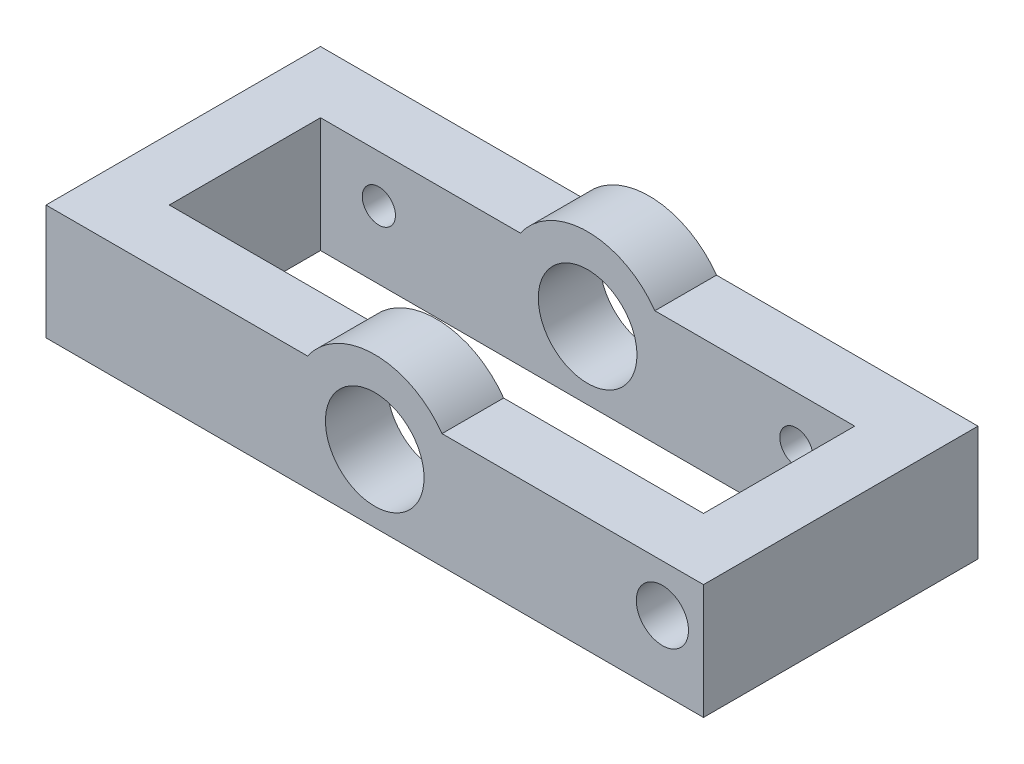
from build123d import *
from build123d.topology import SkipClean

# Parameters (mm, degrees)
SKETCH1_W           = 65
SKETCH1_H           = 18.4
BOSS_EXTRUDE1_DEPTH = 7.5
SKETCH2_R           = 10
BOSS_EXTRUDE2_DEPTH = 7.5
SKETCH3_R           = 6
CUT_EXTRUDE1_DEPTH  = 7.5
BOSS_EXTRUDE3_START = -7.5
SKETCH4_R           = 10
BOSS_EXTRUDE3_DEPTH = 7.5
CUT_EXTRUDE2_START  = -7.5
SKETCH5_R           = 6
CUT_EXTRUDE2_DEPTH  = 7.5
SKETCH6_R           = 2.0193
CUT_EXTRUDE3_DEPTH  = 7.5
CUT_EXTRUDE6_DEPTH  = 81.999212959
SKETCH1_4_W         = 65
SKETCH1_4_H         = 18.4
BOSS_EXTRUDE6_DEPTH = 6.5
SKETCH3_4_R         = 6
CUT_EXTRUDE7_DEPTH  = 81.999212959
SKETCH13_W          = 80
SKETCH13_H          = 33.4
CUT_EXTRUDE8_DEPTH  = 2
SKETCH14_W          = 80
SKETCH14_H          = 33.4
SKETCH14_W_2        = 65
SKETCH14_H_2        = 18.4
BOSS_EXTRUDE7_DEPTH = 2
SKETCH3_5_R         = 6
CUT_EXTRUDE9_DEPTH  = 81.999212959


with BuildPart() as part:
    # Sketch1 → Boss-Extrude1 (new body)
    with BuildSketch(Plane(origin=(0, 0, 0), x_dir=(1, 0, 0), z_dir=(0, 1, 0))):
        Polygon((0, 25.9), (72.5, 25.9), (72.5, -7.5), (-7.5, -7.5), (-7.5, 25.9), align=None)
        with Locations((32.5, 9.2)):
            Rectangle(SKETCH1_W, SKETCH1_H, mode=Mode.SUBTRACT)
    extrude(amount=BOSS_EXTRUDE1_DEPTH)

    # Sketch2 → Boss-Extrude2 (add)
    with BuildSketch(Plane.XY.offset(7.5)):
        with Locations((32.5, 3.75)):
            Circle(SKETCH2_R)
    extrude(amount=-BOSS_EXTRUDE2_DEPTH)

    # Sketch3 → Cut-Extrude1 (cut)
    with BuildSketch(Plane.XY.offset(7.5)):
        with Locations((32.5, 3.75)):
            Circle(SKETCH3_R)
    extrude(amount=-CUT_EXTRUDE1_DEPTH, mode=Mode.SUBTRACT)

    # Sketch4 → Boss-Extrude3 (add)
    with BuildSketch(Plane(origin=(0, 0, -25.9), x_dir=(-1, 0, 0), z_dir=(0, 0, -1)).offset(BOSS_EXTRUDE3_START)):
        with Locations((-32.5, 3.75)):
            Circle(SKETCH4_R)
    extrude(amount=BOSS_EXTRUDE3_DEPTH)

    # Sketch5 → Cut-Extrude2 (cut)
    with BuildSketch(Plane(origin=(0, 0, -25.9), x_dir=(-1, 0, 0), z_dir=(0, 0, -1)).offset(CUT_EXTRUDE2_START)):
        with Locations((-32.5, 3.75)):
            Circle(SKETCH5_R)
    extrude(amount=CUT_EXTRUDE2_DEPTH, mode=Mode.SUBTRACT)

    # Sketch6 → Cut-Extrude3 (cut)
    with BuildSketch(Plane(origin=(0, 0, -25.9), x_dir=(-1, 0, 0), z_dir=(0, 0, -1))):
        with Locations((-7.1, 3.75)):
            Circle(SKETCH6_R)
        with Locations((-57.9, 3.75)):
            Circle(SKETCH6_R)
    extrude(amount=-CUT_EXTRUDE3_DEPTH, mode=Mode.SUBTRACT)

    # Sketch11 → Cut-Extrude6 (cut, through all)
    with BuildSketch(Plane(origin=(0, 0, -25.9), x_dir=(-1, 0, 0), z_dir=(0, 0, -1))):
        with BuildLine():
            ThreePointArc((-70.675, 3.75), (-67.5, 0.575), (-64.325, 3.75))
            ThreePointArc((-64.325, 3.75), (-67.5, 6.925), (-70.675, 3.75))
        make_face()
    extrude(amount=-CUT_EXTRUDE6_DEPTH, mode=Mode.SUBTRACT)

    # Sketch1<4> → Boss-Extrude6 (add)
    with BuildSketch(Plane(origin=(0, 0, 0), x_dir=(1, 0, 0), z_dir=(0, 1, 0))):
        Polygon((0, 25.9), (72.5, 25.9), (72.5, -7.5), (-7.5, -7.5), (-7.5, 25.9), align=None)
        with Locations((32.5, 9.2)):
            Rectangle(SKETCH1_4_W, SKETCH1_4_H, mode=Mode.SUBTRACT)
    extrude(amount=-BOSS_EXTRUDE6_DEPTH)

    # Sketch3<4> → Cut-Extrude7 (cut, through all)
    with BuildSketch(Plane.XY.offset(7.5)):
        with Locations((32.5, 3.75)):
            Circle(SKETCH3_4_R)
    extrude(amount=-CUT_EXTRUDE7_DEPTH, mode=Mode.SUBTRACT)

    # Sketch13 → Cut-Extrude8 (cut)
    with BuildSketch(Plane.XZ.offset(6.5)):
        with Locations((32.5, -9.2)):
            Rectangle(SKETCH13_W, SKETCH13_H)
    extrude(amount=-CUT_EXTRUDE8_DEPTH, mode=Mode.SUBTRACT)

    # Sketch14 → Boss-Extrude7 (add)
    with BuildSketch(Plane(origin=(0, 7.5, 0), x_dir=(1, 0, 0), z_dir=(0, 1, 0))):
        with Locations((32.5, 9.2)):
            Rectangle(SKETCH14_W, SKETCH14_H)
        with Locations((32.5, 9.2)):
            Rectangle(SKETCH14_W_2, SKETCH14_H_2, mode=Mode.SUBTRACT)
    extrude(amount=BOSS_EXTRUDE7_DEPTH)

    # Sketch3<5> → Cut-Extrude9 (cut, through all)
    with SkipClean():  # the faces are left unmerged after this step: merging them gives an invalid solid
        with BuildSketch(Plane.XY.offset(7.5)):
            with Locations((32.5, 3.75)):
                Circle(SKETCH3_5_R)
        extrude(amount=-CUT_EXTRUDE9_DEPTH, mode=Mode.SUBTRACT)


solid = part.part
